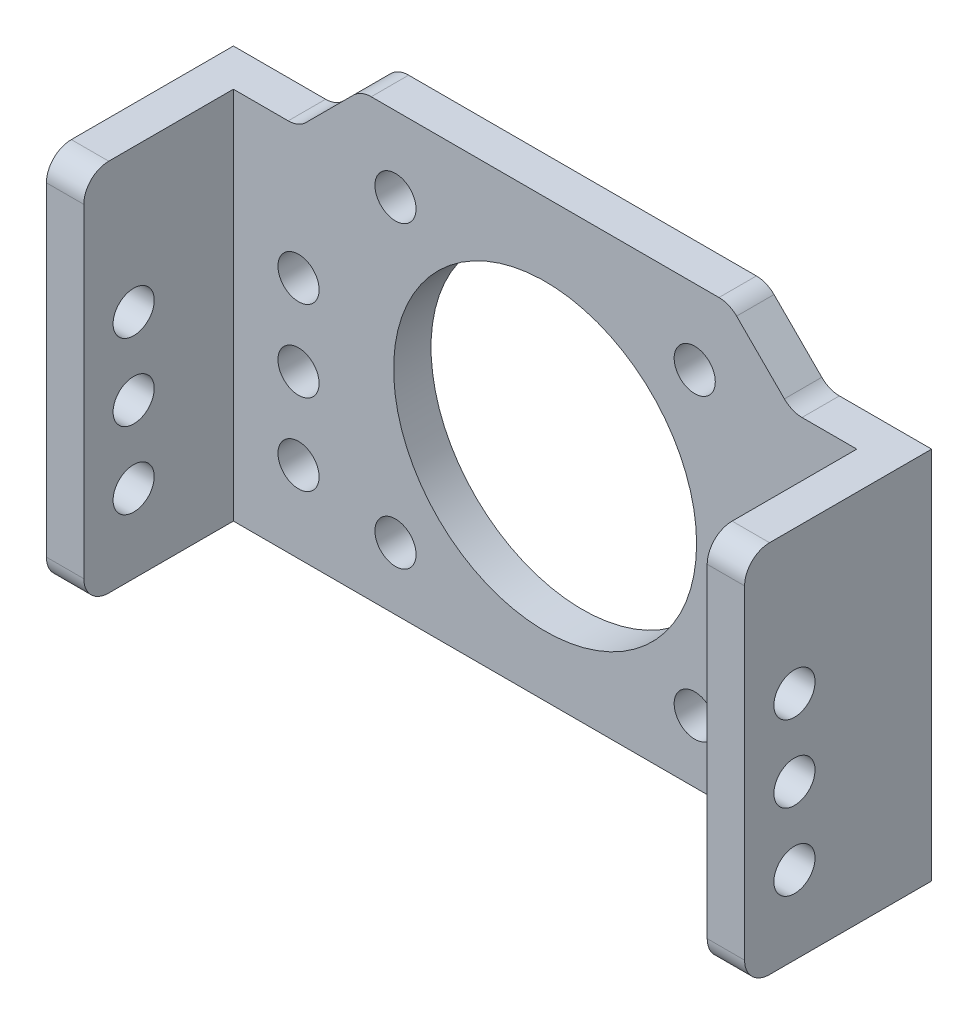
from build123d import *

# Parameters (mm, degrees)
SKETCH_1_R          = 1.65
SKETCH_1_R_2        = 12.15
EXTRUDE_6_DEPTH     = 3
SKETCH_4_W          = 3
SKETCH_4_H          = 30
EXTRUDE_7_DEPTH     = 12
SKETCH_5_R          = 1.65
CUT_EXTRUDE_1_DEPTH = 56
FILLET_6_R          = 2


with BuildPart() as part:
    # 草图1 → 凸台-拉伸6 (new body)
    with BuildSketch(Plane.XY):
        Polygon((0, 30), (0, 0), (56, 0), (56, 30), (47.77634117, 30), (42.77391153, 35.00242964), (13.226088475, 35.00242964), (8.223658835, 30), align=None)
        with Locations((16, 29)):
            Circle(SKETCH_1_R, mode=Mode.SUBTRACT)
        with Locations((40, 29)):
            Circle(SKETCH_1_R, mode=Mode.SUBTRACT)
        with Locations((8.223658835, 6.5)):
            Circle(SKETCH_1_R, mode=Mode.SUBTRACT)
        with Locations((16, 5)):
            Circle(SKETCH_1_R, mode=Mode.SUBTRACT)
        with Locations((8.223658835, 13)):
            Circle(SKETCH_1_R, mode=Mode.SUBTRACT)
        with Locations((40, 5)):
            Circle(SKETCH_1_R, mode=Mode.SUBTRACT)
        with Locations((47.77634117, 6.5)):
            Circle(SKETCH_1_R, mode=Mode.SUBTRACT)
        with Locations((28, 17)):
            Circle(SKETCH_1_R_2, mode=Mode.SUBTRACT)
        with Locations((47.77634117, 13)):
            Circle(SKETCH_1_R, mode=Mode.SUBTRACT)
        with Locations((8.223658835, 19.5)):
            Circle(SKETCH_1_R, mode=Mode.SUBTRACT)
        with Locations((47.77634117, 19.5)):
            Circle(SKETCH_1_R, mode=Mode.SUBTRACT)
    extrude(amount=EXTRUDE_6_DEPTH)

    # 草图4 → 凸台-拉伸7 (add)
    with BuildSketch(Plane.XY.offset(3)):
        with Locations((1.5, 15)):
            Rectangle(SKETCH_4_W, SKETCH_4_H)
        with Locations((54.5, 15)):
            Rectangle(SKETCH_4_W, SKETCH_4_H)
    extrude(amount=EXTRUDE_7_DEPTH)

    # 草图5 → 切除-拉伸1 (cut)
    with BuildSketch(Plane(origin=(56, 0, 0), x_dir=(0, 0, -1), z_dir=(1, 0, 0))):
        with Locations((-11, 18.525)):
            Circle(SKETCH_5_R)
        with BuildLine():
            ThreePointArc((-9.35, 12.4), (-12.166726189, 13.566726189), (-11, 10.75))
            Line((-11, 10.75), (-11, 12.4))
            Line((-11, 12.4), (-9.35, 12.4))
        make_face()
        with BuildLine():
            Line((-11, 12.4), (-11, 10.75))
            ThreePointArc((-11, 10.75), (-9.833273811, 11.233273811), (-9.35, 12.4))
            Line((-9.35, 12.4), (-11, 12.4))
        make_face()
        with BuildLine():
            ThreePointArc((-11, 7.925), (-12.65, 6.275), (-11, 4.625))
            Line((-11, 4.625), (-11, 6.275))
            Line((-11, 6.275), (-11, 7.925))
        make_face()
        with BuildLine():
            Line((-11, 6.275), (-11, 4.625))
            ThreePointArc((-11, 4.625), (-9.833273811, 5.108273811), (-9.35, 6.275))
            ThreePointArc((-9.35, 6.275), (-9.833273811, 7.441726189), (-11, 7.925))
            Line((-11, 7.925), (-11, 6.275))
        make_face()
    extrude(amount=-CUT_EXTRUDE_1_DEPTH, mode=Mode.SUBTRACT)

    # 圆角6
    fillet_6_edges = [part.edges().sort_by_distance(p)[0] for p in [
        (8.223658835, 30, 1.5),
        (13.226088475, 35.00242964, 1.5),
        (42.77391153, 35.00242964, 1.5),
        (47.77634117, 30, 1.5),
        (1.5, 30, 15),
        (1.5, 0, 15),
        (54.5, 30, 15),
        (54.5, 0, 15),
    ]]
    fillet(fillet_6_edges, radius=FILLET_6_R)


solid = part.part
